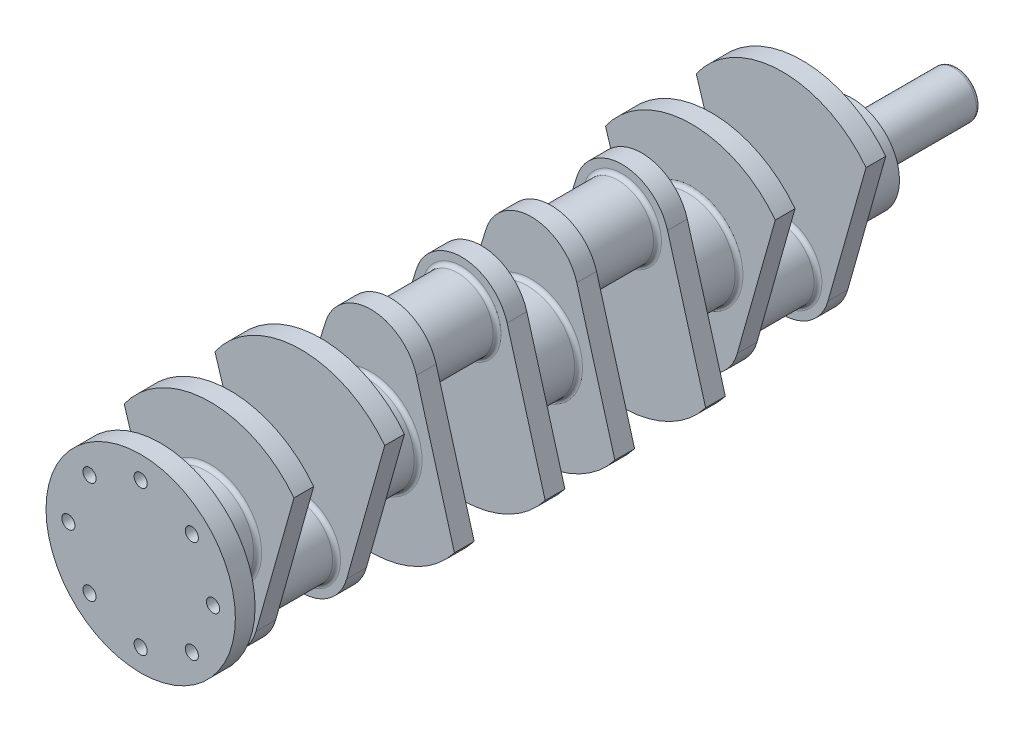
from build123d import *

# Parameters (mm, degrees)
Y_KSEKLIK_EKSTR_ZYON1_DEPTH = 15
IZIM2_R                     = 27
Y_KSEKLIK_EKSTR_ZYON2_DEPTH = 54
IZIM3_R                     = 36
Y_KSEKLIK_EKSTR_ZYON3_DEPTH = 38
G_VDE_TA_KOPYALA1_ANGLE     = 180
IZIM4_R                     = 17.5
Y_KSEKLIK_EKSTR_ZYON4_DEPTH = 80
IZIM5_R                     = 72
IZIM5_R_2                   = 5
Y_KSEKLIK_EKSTR_ZYON5_DEPTH = 15
RADYUS1_R                   = 3


with BuildPart() as part:
    # Çizim1 → Yükseklik-Ekstrüzyon1 (new body)
    with BuildSketch(Plane.XY):
        with BuildLine():
            Line((-34.3864765, -54.656933609), (-65.542043825, 45.872001169))
            ThreePointArc((-65.542043825, 45.872001169), (-1.669617793, 79.982575455), (63.570647333, 48.567198783))
            Line((63.570647333, 48.567198783), (34.643107812, -53.790560816))
            ThreePointArc((34.643107812, -53.790560816), (0.451791281, -79.997164953), (-34.3864765, -54.656933609))
        make_face()
    y_kseklik_ekstr_zyon1 = extrude(amount=Y_KSEKLIK_EKSTR_ZYON1_DEPTH)

    # Çizim2 → Yükseklik-Ekstrüzyon2 (add)
    with BuildSketch(Plane(origin=(0, 0, 0), x_dir=(-1, 0, 0), z_dir=(0, 0, -1))):
        with Locations((0, -44)):
            Circle(IZIM2_R)
    extrude(amount=Y_KSEKLIK_EKSTR_ZYON2_DEPTH)

    # Çizim3 → Yükseklik-Ekstrüzyon3 (add)
    with BuildSketch(Plane.XY.offset(15)):
        Circle(IZIM3_R)
    y_kseklik_ekstr_zyon3 = extrude(amount=Y_KSEKLIK_EKSTR_ZYON3_DEPTH)

    # Aynalama1: Yükseklik-Ekstrüzyon1, Yükseklik-Ekstrüzyon3 across plane
    add(y_kseklik_ekstr_zyon1.mirror(Plane(origin=(0, 0, -27), x_dir=(1, 0, 0), z_dir=(0, 0, -1))))
    add(y_kseklik_ekstr_zyon3.mirror(Plane(origin=(0, 0, -27), x_dir=(1, 0, 0), z_dir=(0, 0, -1))))


with BuildPart() as body_2:
    # Aynalama4: mirrored copy
    add(part.part.mirror(Plane.XY.offset(34)))


with BuildPart() as body_2_1:
    # Gövde-Taşı/Kopyala1: moved
    add(body_2.part.rotate(Axis((0, 0, 95), (1, 0, 0)), G_VDE_TA_KOPYALA1_ANGLE))


with BuildPart() as body_3:
    # Aynalama5: mirrored copy
    add(part.part.mirror(Plane.XY.offset(156)))

    # Çizim5 → Yükseklik-Ekstrüzyon5 (add)
    with BuildSketch(Plane.XY.offset(419)):
        Circle(IZIM5_R)
        with Locations((0, 55)):
            Circle(IZIM5_R_2, mode=Mode.SUBTRACT)
        with Locations((38.890872965, 38.890872965)):
            Circle(IZIM5_R_2, mode=Mode.SUBTRACT)
        with Locations((55, 0)):
            Circle(IZIM5_R_2, mode=Mode.SUBTRACT)
        with Locations((38.890872965, -38.890872965)):
            Circle(IZIM5_R_2, mode=Mode.SUBTRACT)
        with Locations((0, -55)):
            Circle(IZIM5_R_2, mode=Mode.SUBTRACT)
        with Locations((-38.890872965, -38.890872965)):
            Circle(IZIM5_R_2, mode=Mode.SUBTRACT)
        with Locations((-55, 0)):
            Circle(IZIM5_R_2, mode=Mode.SUBTRACT)
        with Locations((-38.890872965, 38.890872965)):
            Circle(IZIM5_R_2, mode=Mode.SUBTRACT)
    extrude(amount=Y_KSEKLIK_EKSTR_ZYON5_DEPTH)


with BuildPart() as body_4:
    # Aynalama5 2: mirrored copy
    add(body_2_1.part.mirror(Plane.XY.offset(156)))


with BuildPart() as part_1:
    add(part.part)

    # Çizim4 → Yükseklik-Ekstrüzyon4 (add)
    with BuildSketch(Plane(origin=(0, 0, -107), x_dir=(-1, 0, 0), z_dir=(0, 0, -1))):
        Circle(IZIM4_R)
    extrude(amount=Y_KSEKLIK_EKSTR_ZYON4_DEPTH)

    # Birleştir1: union body 2, body 4, body 3
    add(body_2_1.part)
    add(body_4.part)
    add(body_3.part)

    # Radyus1
    radyus1_edges = [part_1.edges().sort_by_distance(p)[0] for p in [
        (-36, 0, 381),
        (-36, 0, 419),
        (27, -44, 366),
        (27, -44, 312),
        (-36, 0, 297),
        (-36, 0, 259),
        (27, 44, 244),
        (27, 44, 190),
        (-36, 0, 175),
        (27, 44, 68),
        (27, 44, 122),
        (-36, 0, 137),
        (-36, 0, -69),
        (-36, 0, 53),
        (27, -44, -54),
        (27, -44, 0),
        (-36, 0, 15),
        (17.5, 0, -107),
        (17.5, 0, -187),
    ]]
    fillet(radyus1_edges, radius=RADYUS1_R)


solid = part_1.part
